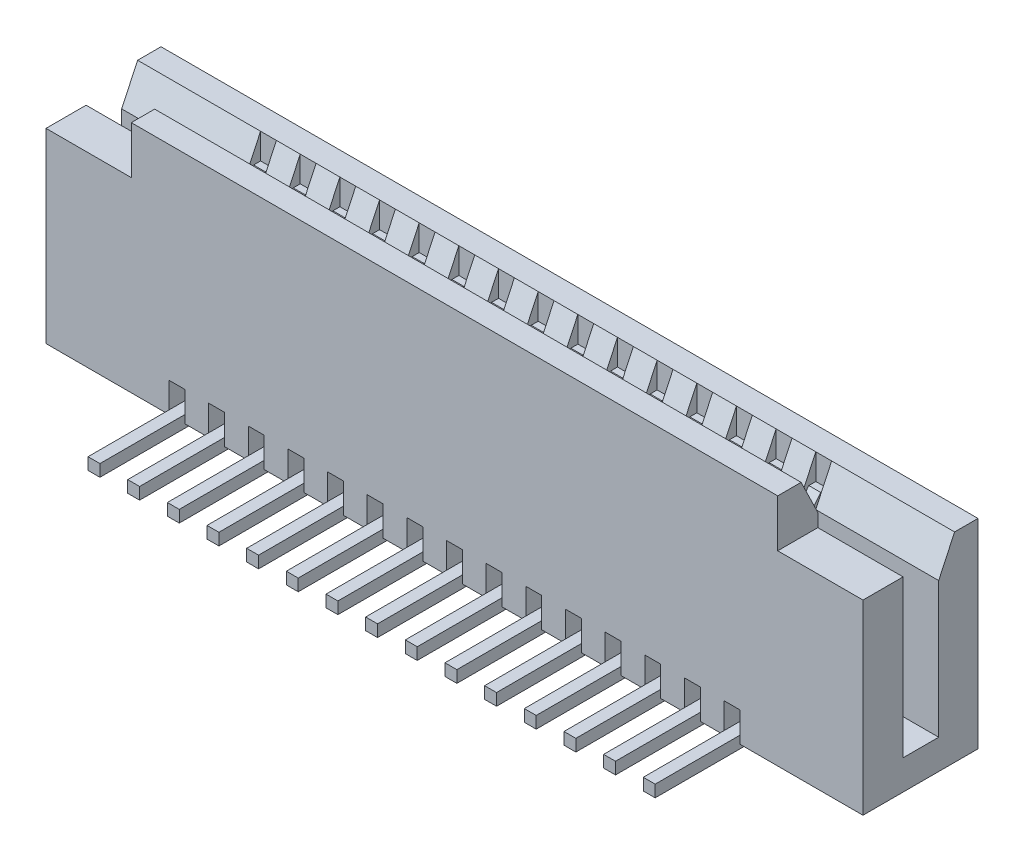
from build123d import *

# Parameters (mm, degrees)
SKETCH1_W                = 20.6
SKETCH1_H                = 2.9
BOSS_EXTRUDE1_DEPTH      = 5.9
CUT_EXTRUDE1_DEPTH       = 22.477255411
CUT_EXTRUDE2_DEPTH       = 22.477255411
CUT_EXTRUDE2_DEPTH_BACK  = 22.477255411
SKETCH5_W                = 20.6
SKETCH5_H                = 0.897511013
CUT_EXTRUDE3_DEPTH       = 3.421172811
SKETCH3_W                = 0.4
SKETCH3_H                = 6.863884208
CUT_EXTRUDE4_DEPTH       = 0.75
SKETCH6_W                = 0.4
SKETCH6_H                = 1.719871284
CUT_EXTRUDE5_DEPTH       = 12.958365273
SURFACE_EXTRUDE1_1_BACK  = 0.15
SURFACE_EXTRUDE1_1_DEPTH = 0.3
THICKEN1_T1              = 0.15
THICKEN1_T2              = 0.15
LPATTERN3_COUNT          = 15
LPATTERN3_PITCH          = 1
SURFACE_EXTRUDE2_2_BACK  = 0.15
SURFACE_EXTRUDE2_2_DEPTH = 0.3
THICKEN2_T1              = 0.15
THICKEN2_T2              = 0.15
LPATTERN4_COUNT          = 15
LPATTERN4_PITCH          = 1
SKETCH10_W               = 2.15
SKETCH10_H               = 1.2
CUT_EXTRUDE6_DEPTH       = 1.2


with BuildPart() as part:
    # Sketch1 → Boss-Extrude1 (new body)
    with BuildSketch(Plane(origin=(0, 0, 0), x_dir=(1, 0, 0), z_dir=(0, 1, 0))):
        Rectangle(SKETCH1_W, SKETCH1_H)
    extrude(amount=BOSS_EXTRUDE1_DEPTH)

    # Sketch2 → Cut-Extrude1 (cut, through all)
    with BuildSketch(Plane(origin=(10.3, 0, 0), x_dir=(0, 0, -1), z_dir=(1, 0, 0))):
        Polygon((-0.859871284, 5.9), (-0.438998362, 5.032165209), (1.45, 5.032165209), (1.45, 5.9), align=None)
    extrude(amount=-CUT_EXTRUDE1_DEPTH, mode=Mode.SUBTRACT)

    # Sketch4 → Cut-Extrude2 (cut, two sides: drawn at the far end of the back side and taken through both)
    with BuildSketch(Plane.ZY.offset(10.3).offset(-CUT_EXTRUDE2_DEPTH_BACK)):
        Polygon((-9.766289128, 24.13176388), (-0.86, 5.032165209), (-0.458512651, 4.171172811), (0.438998362, 4.171172811), (0.438998362, 5.032165209), (0.438998362, 26.106240644), (-7.567180708, 67.487005723), (-17.772468198, 65.512528959), align=None)
    extrude(amount=CUT_EXTRUDE2_DEPTH + CUT_EXTRUDE2_DEPTH_BACK, mode=Mode.SUBTRACT)

    # Sketch5 → Cut-Extrude3 (cut)
    with BuildSketch(Plane(origin=(0, 4.171172811, 0), x_dir=(1, 0, 0), z_dir=(0, 1, 0))):
        with Locations((0, 0.009757145)):
            Rectangle(SKETCH5_W, SKETCH5_H)
    extrude(amount=-CUT_EXTRUDE3_DEPTH, mode=Mode.SUBTRACT)

    # Sketch3 → Cut-Extrude4 (cut)
    with BuildSketch(Plane.XZ):
        with Locations((-7, -0.729625487)):
            Rectangle(SKETCH3_W, SKETCH3_H)
        with Locations((-6, -0.729625487)):
            Rectangle(SKETCH3_W, SKETCH3_H)
        with Locations((-5, -0.729625487)):
            Rectangle(SKETCH3_W, SKETCH3_H)
        with Locations((-4, -0.729625487)):
            Rectangle(SKETCH3_W, SKETCH3_H)
        with Locations((-3, -0.729625487)):
            Rectangle(SKETCH3_W, SKETCH3_H)
        with Locations((-2, -0.729625487)):
            Rectangle(SKETCH3_W, SKETCH3_H)
        with Locations((-1, -0.729625487)):
            Rectangle(SKETCH3_W, SKETCH3_H)
        with Locations((0, -0.729625487)):
            Rectangle(SKETCH3_W, SKETCH3_H)
        with Locations((1, -0.729625487)):
            Rectangle(SKETCH3_W, SKETCH3_H)
        with Locations((2, -0.729625487)):
            Rectangle(SKETCH3_W, SKETCH3_H)
        with Locations((3, -0.729625487)):
            Rectangle(SKETCH3_W, SKETCH3_H)
        with Locations((4, -0.729625487)):
            Rectangle(SKETCH3_W, SKETCH3_H)
        with Locations((5, -0.729625487)):
            Rectangle(SKETCH3_W, SKETCH3_H)
        with Locations((6, -0.729625487)):
            Rectangle(SKETCH3_W, SKETCH3_H)
        with Locations((7, -0.729625487)):
            Rectangle(SKETCH3_W, SKETCH3_H)
    extrude(amount=-CUT_EXTRUDE4_DEPTH, mode=Mode.SUBTRACT)

    # Sketch6 → Cut-Extrude5 (cut, through all)
    with BuildSketch(Plane(origin=(0, 5.9, 0), x_dir=(1, 0, 0), z_dir=(0, 1, 0))):
        with Locations((-7, 6.4358e-05)):
            Rectangle(SKETCH6_W, SKETCH6_H)
        with Locations((-6, 6.4358e-05)):
            Rectangle(SKETCH6_W, SKETCH6_H)
        with Locations((-5, 6.4358e-05)):
            Rectangle(SKETCH6_W, SKETCH6_H)
        with Locations((-4, 6.4358e-05)):
            Rectangle(SKETCH6_W, SKETCH6_H)
        with Locations((-3, 6.4358e-05)):
            Rectangle(SKETCH6_W, SKETCH6_H)
        with Locations((-2, 6.4358e-05)):
            Rectangle(SKETCH6_W, SKETCH6_H)
        with Locations((-1, 6.4358e-05)):
            Rectangle(SKETCH6_W, SKETCH6_H)
        with Locations((0, 6.4358e-05)):
            Rectangle(SKETCH6_W, SKETCH6_H)
        with Locations((1, 6.4358e-05)):
            Rectangle(SKETCH6_W, SKETCH6_H)
        with Locations((2, 6.4358e-05)):
            Rectangle(SKETCH6_W, SKETCH6_H)
        with Locations((3, 6.4358e-05)):
            Rectangle(SKETCH6_W, SKETCH6_H)
        with Locations((4, 6.4358e-05)):
            Rectangle(SKETCH6_W, SKETCH6_H)
        with Locations((5, 6.4358e-05)):
            Rectangle(SKETCH6_W, SKETCH6_H)
        with Locations((6, 6.4358e-05)):
            Rectangle(SKETCH6_W, SKETCH6_H)
        with Locations((7, 6.4358e-05)):
            Rectangle(SKETCH6_W, SKETCH6_H)
    extrude(amount=-CUT_EXTRUDE5_DEPTH, mode=Mode.SUBTRACT)

    # Sketch10 → Cut-Extrude6 (cut)
    with BuildSketch(Plane.XY.offset(1.45)):
        with Locations((-9.225, 5.3)):
            Rectangle(SKETCH10_W, SKETCH10_H)
        with Locations((9.225, 5.3)):
            Rectangle(SKETCH10_W, SKETCH10_H)
    extrude(amount=-CUT_EXTRUDE6_DEPTH, mode=Mode.SUBTRACT)


with BuildPart() as body_2:
    # Surface-Extrude1: a surface, the sketch's curves swept straight by 0.3 mm
    with BuildLine(Plane(origin=(7, 0, 0), x_dir=(0, 0, -1), z_dir=(1, 0, 0)).offset(-SURFACE_EXTRUDE1_1_BACK), mode=Mode.PRIVATE) as surface_extrude1_1_path:
        Line((2.324335617, 0), (0.618512651, 0))
        Line((0.618512651, 0), (0.618512651, 4.171172811))
        Line((0.618512651, 4.171172811), (0.706676367, 4.282932038))
        Line((0.706676367, 4.282932038), (0.810305597, 4.282932038))
    surface_extrude1_1 = Shell.extrude(surface_extrude1_1_path.wire(), (1 * SURFACE_EXTRUDE1_1_DEPTH, 0 * SURFACE_EXTRUDE1_1_DEPTH, 0 * SURFACE_EXTRUDE1_1_DEPTH))
    add(Solid.thicken(surface_extrude1_1, THICKEN1_T1))
    add(Solid.thicken(surface_extrude1_1, -THICKEN1_T2))


with BuildPart() as lpattern3_1:
    # LPattern3: pattern copy
    add(body_2.part.moved(Location(Vector(-1, 0, 0) * (1 * LPATTERN3_PITCH))))


with BuildPart() as lpattern3_2:
    # LPattern3: pattern copy
    add(body_2.part.moved(Location(Vector(-1, 0, 0) * (2 * LPATTERN3_PITCH))))


with BuildPart() as lpattern3_3:
    # LPattern3: pattern copy
    add(body_2.part.moved(Location(Vector(-1, 0, 0) * (3 * LPATTERN3_PITCH))))


with BuildPart() as lpattern3_4:
    # LPattern3: pattern copy
    add(body_2.part.moved(Location(Vector(-1, 0, 0) * (4 * LPATTERN3_PITCH))))


with BuildPart() as lpattern3_5:
    # LPattern3: pattern copy
    add(body_2.part.moved(Location(Vector(-1, 0, 0) * (5 * LPATTERN3_PITCH))))


with BuildPart() as lpattern3_6:
    # LPattern3: pattern copy
    add(body_2.part.moved(Location(Vector(-1, 0, 0) * (6 * LPATTERN3_PITCH))))


with BuildPart() as lpattern3_7:
    # LPattern3: pattern copy
    add(body_2.part.moved(Location(Vector(-1, 0, 0) * (7 * LPATTERN3_PITCH))))


with BuildPart() as lpattern3_8:
    # LPattern3: pattern copy
    add(body_2.part.moved(Location(Vector(-1, 0, 0) * (8 * LPATTERN3_PITCH))))


with BuildPart() as lpattern3_9:
    # LPattern3: pattern copy
    add(body_2.part.moved(Location(Vector(-1, 0, 0) * (9 * LPATTERN3_PITCH))))


with BuildPart() as lpattern3_10:
    # LPattern3: pattern copy
    add(body_2.part.moved(Location(Vector(-1, 0, 0) * (10 * LPATTERN3_PITCH))))


with BuildPart() as lpattern3_11:
    # LPattern3: pattern copy
    add(body_2.part.moved(Location(Vector(-1, 0, 0) * (11 * LPATTERN3_PITCH))))


with BuildPart() as lpattern3_12:
    # LPattern3: pattern copy
    add(body_2.part.moved(Location(Vector(-1, 0, 0) * (12 * LPATTERN3_PITCH))))


with BuildPart() as lpattern3_13:
    # LPattern3: pattern copy
    add(body_2.part.moved(Location(Vector(-1, 0, 0) * (13 * LPATTERN3_PITCH))))


with BuildPart() as lpattern3_14:
    # LPattern3: pattern copy
    add(body_2.part.moved(Location(Vector(-1, 0, 0) * (14 * LPATTERN3_PITCH))))


with BuildPart() as body_17:
    # Surface-Extrude2: a surface, the sketch's curves swept straight by 0.3 mm
    with BuildLine(Plane(origin=(7, 0, 0), x_dir=(0, 0, -1), z_dir=(1, 0, 0)).offset(-SURFACE_EXTRUDE2_2_BACK), mode=Mode.PRIVATE) as surface_extrude2_2_path:
        Line((-3.540018861, 0), (-0.517559694, 0))
        Line((-0.517559694, 0), (-0.517559694, 4.36783966))
        Line((-0.517559694, 4.36783966), (-0.17495155, 4.785654471))
        Line((-0.17495155, 4.785654471), (-0.275227104, 5.032165209))
        Line((-0.275227104, 5.032165209), (-0.718249464, 5.032165209))
    surface_extrude2_2 = Shell.extrude(surface_extrude2_2_path.wire(), (1 * SURFACE_EXTRUDE2_2_DEPTH, 0 * SURFACE_EXTRUDE2_2_DEPTH, 0 * SURFACE_EXTRUDE2_2_DEPTH))
    add(Solid.thicken(surface_extrude2_2, THICKEN2_T1))
    add(Solid.thicken(surface_extrude2_2, -THICKEN2_T2))


with BuildPart() as lpattern4_1:
    # LPattern4: pattern copy
    add(body_17.part.moved(Location(Vector(-1, 0, 0) * (1 * LPATTERN4_PITCH))))


with BuildPart() as lpattern4_2:
    # LPattern4: pattern copy
    add(body_17.part.moved(Location(Vector(-1, 0, 0) * (2 * LPATTERN4_PITCH))))


with BuildPart() as lpattern4_3:
    # LPattern4: pattern copy
    add(body_17.part.moved(Location(Vector(-1, 0, 0) * (3 * LPATTERN4_PITCH))))


with BuildPart() as lpattern4_4:
    # LPattern4: pattern copy
    add(body_17.part.moved(Location(Vector(-1, 0, 0) * (4 * LPATTERN4_PITCH))))


with BuildPart() as lpattern4_5:
    # LPattern4: pattern copy
    add(body_17.part.moved(Location(Vector(-1, 0, 0) * (5 * LPATTERN4_PITCH))))


with BuildPart() as lpattern4_6:
    # LPattern4: pattern copy
    add(body_17.part.moved(Location(Vector(-1, 0, 0) * (6 * LPATTERN4_PITCH))))


with BuildPart() as lpattern4_7:
    # LPattern4: pattern copy
    add(body_17.part.moved(Location(Vector(-1, 0, 0) * (7 * LPATTERN4_PITCH))))


with BuildPart() as lpattern4_8:
    # LPattern4: pattern copy
    add(body_17.part.moved(Location(Vector(-1, 0, 0) * (8 * LPATTERN4_PITCH))))


with BuildPart() as lpattern4_9:
    # LPattern4: pattern copy
    add(body_17.part.moved(Location(Vector(-1, 0, 0) * (9 * LPATTERN4_PITCH))))


with BuildPart() as lpattern4_10:
    # LPattern4: pattern copy
    add(body_17.part.moved(Location(Vector(-1, 0, 0) * (10 * LPATTERN4_PITCH))))


with BuildPart() as lpattern4_11:
    # LPattern4: pattern copy
    add(body_17.part.moved(Location(Vector(-1, 0, 0) * (11 * LPATTERN4_PITCH))))


with BuildPart() as lpattern4_12:
    # LPattern4: pattern copy
    add(body_17.part.moved(Location(Vector(-1, 0, 0) * (12 * LPATTERN4_PITCH))))


with BuildPart() as lpattern4_13:
    # LPattern4: pattern copy
    add(body_17.part.moved(Location(Vector(-1, 0, 0) * (13 * LPATTERN4_PITCH))))


with BuildPart() as lpattern4_14:
    # LPattern4: pattern copy
    add(body_17.part.moved(Location(Vector(-1, 0, 0) * (14 * LPATTERN4_PITCH))))


solid = Compound([part.part, body_2.part, lpattern3_1.part, lpattern3_2.part, lpattern3_3.part, lpattern3_4.part, lpattern3_5.part, lpattern3_6.part, lpattern3_7.part, lpattern3_8.part, lpattern3_9.part, lpattern3_10.part, lpattern3_11.part, lpattern3_12.part, lpattern3_13.part, lpattern3_14.part, body_17.part, lpattern4_1.part, lpattern4_2.part, lpattern4_3.part, lpattern4_4.part, lpattern4_5.part, lpattern4_6.part, lpattern4_7.part, lpattern4_8.part, lpattern4_9.part, lpattern4_10.part, lpattern4_11.part, lpattern4_12.part, lpattern4_13.part, lpattern4_14.part])
